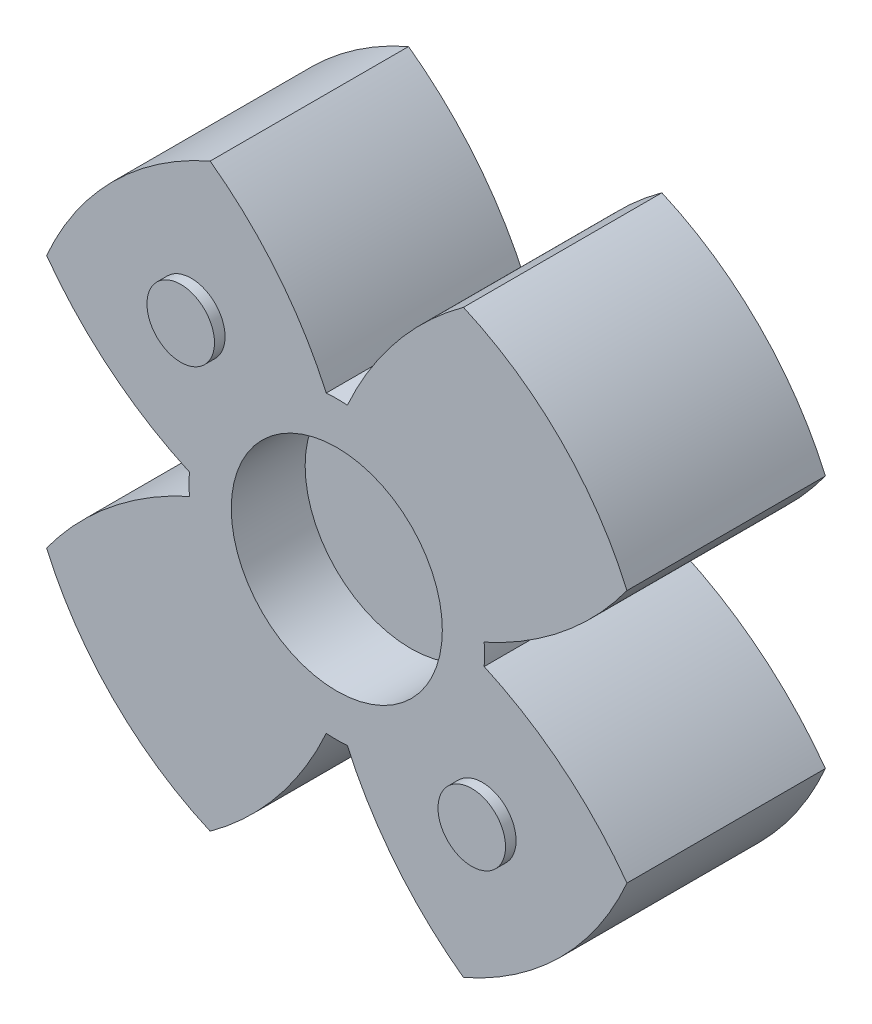
from build123d import *

# Parameters (mm, degrees)
BOSS_EXTRUDE1_DEPTH = 9.4
SKETCH2_R           = 5
CUT_EXTRUDE1_DEPTH  = 3.5
CUT_EXTRUDE2_START  = -3.5
SKETCH3_R           = 5
CUT_EXTRUDE2_DEPTH  = 3.5
SKETCH4_R           = 1.6
BOSS_EXTRUDE2_DEPTH = 0.5
SKETCH5_R           = 1.6
BOSS_EXTRUDE3_DEPTH = 0.5


with BuildPart() as part:
    # Sketch1 → Boss-Extrude1 (new body)
    with BuildSketch(Plane.XY):
        with BuildLine():
            ThreePointArc((6, -13.747727085), (10.606601718, -10.606601718), (13.747727085, -6))
            ThreePointArc((13.747727085, -6), (10.72353208, -2.808871931), (6.982120022, -0.5))
            ThreePointArc((6.982120022, -0.5), (7, 0), (6.982120022, 0.5))
            ThreePointArc((6.982120022, 0.5), (10.72353208, 2.808871931), (13.747727085, 6))
            ThreePointArc((13.747727085, 6), (10.606601718, 10.606601718), (6, 13.747727085))
            ThreePointArc((6, 13.747727085), (2.808871931, 10.72353208), (0.5, 6.982120022))
            ThreePointArc((0.5, 6.982120022), (0, 7), (-0.5, 6.982120022))
            ThreePointArc((-0.5, 6.982120022), (-2.808871931, 10.72353208), (-6, 13.747727085))
            ThreePointArc((-6, 13.747727085), (-10.606601718, 10.606601718), (-13.747727085, 6))
            ThreePointArc((-13.747727085, 6), (-10.72353208, 2.808871931), (-6.982120022, 0.5))
            ThreePointArc((-6.982120022, 0.5), (-7, 0), (-6.982120022, -0.5))
            ThreePointArc((-6.982120022, -0.5), (-10.72353208, -2.808871931), (-13.747727085, -6))
            ThreePointArc((-13.747727085, -6), (-10.606601718, -10.606601718), (-6, -13.747727085))
            ThreePointArc((-6, -13.747727085), (-2.808871931, -10.72353208), (-0.5, -6.982120022))
            ThreePointArc((-0.5, -6.982120022), (0, -7), (0.5, -6.982120022))
            ThreePointArc((0.5, -6.982120022), (2.808871931, -10.72353208), (6, -13.747727085))
        make_face()
    extrude(amount=BOSS_EXTRUDE1_DEPTH)

    # Sketch2 → Cut-Extrude1 (cut)
    with BuildSketch(Plane.XY.offset(9.4)):
        Circle(SKETCH2_R)
    extrude(amount=-CUT_EXTRUDE1_DEPTH, mode=Mode.SUBTRACT)

    # Sketch3 → Cut-Extrude2 (cut)
    with BuildSketch(Plane(origin=(0, 0, 0), x_dir=(-1, 0, 0), z_dir=(0, 0, -1)).offset(CUT_EXTRUDE2_START)):
        with Locations(Location((0, 0, 0), (0, 0, 180))):
            Circle(SKETCH3_R)
    extrude(amount=CUT_EXTRUDE2_DEPTH, mode=Mode.SUBTRACT)

    # Sketch4 → Boss-Extrude2 (add)
    with BuildSketch(Plane.XY.offset(9.4)):
        with Locations((-6.894291117, 6.894291117)):
            Circle(SKETCH4_R)
        with Locations((6.894291117, -6.894291117)):
            Circle(SKETCH4_R)
    extrude(amount=BOSS_EXTRUDE2_DEPTH)

    # Sketch5 → Boss-Extrude3 (add)
    with BuildSketch(Plane(origin=(0, 0, 0), x_dir=(-1, 0, 0), z_dir=(0, 0, -1))):
        with Locations(Location((-6.894291117, 6.894291117, 0), (0, 0, 180))):
            Circle(SKETCH5_R)
        with Locations(Location((6.894291117, -6.894291117, 0), (0, 0, 180))):
            Circle(SKETCH5_R)
    extrude(amount=BOSS_EXTRUDE3_DEPTH)


solid = part.part
